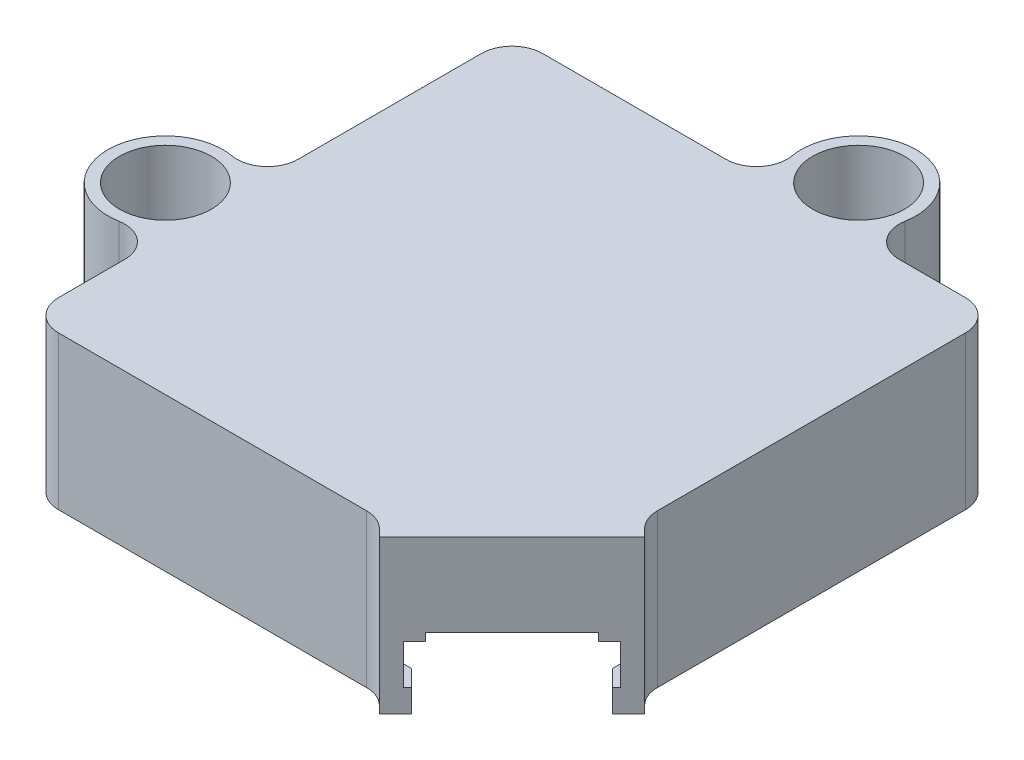
from build123d import *

# Parameters (mm, degrees)
SKETCH1_W           = 31.6
SKETCH1_H           = 31.6
SKETCH1_W_2         = 28.6
SKETCH1_H_2         = 28.6
BOSS_EXTRUDE1_DEPTH = 10
SKETCH2_W           = 31.6
SKETCH2_H           = 31.6
BOSS_EXTRUDE2_DEPTH = 1.5
FILLET2_R           = 2
SKETCH3_R           = 3.75
SKETCH3_R_2         = 1.75
BOSS_EXTRUDE3_DEPTH = 10
SKETCH4_R           = 3
CUT_EXTRUDE1_DEPTH  = 8.5
CUT_EXTRUDE2_REACH  = 35.43
SKETCH6_W           = 29.5
SKETCH6_H           = 29.5
CUT_EXTRUDE3_DEPTH  = 1.5
FILLET3_R           = 2
BOSS_EXTRUDE4_DEPTH = 5.4
BOSS_EXTRUDE5_DEPTH = 4.6
BOSS_EXTRUDE6_DEPTH = 3.1
FILLET4_R           = 2
CUT_EXTRUDE6_START  = -2.5
SKETCH12_W          = 10
SKETCH12_H          = 2.6
CUT_EXTRUDE6_DEPTH  = 2.5


with BuildPart() as part:
    # Sketch1 → Boss-Extrude1 (new body)
    with BuildSketch(Plane(origin=(0, 0, 0), x_dir=(1, 0, 0), z_dir=(0, 1, 0))):
        Rectangle(SKETCH1_W, SKETCH1_H)
        Rectangle(SKETCH1_W_2, SKETCH1_H_2, mode=Mode.SUBTRACT)
    extrude(amount=BOSS_EXTRUDE1_DEPTH)

    # Sketch2 → Boss-Extrude2 (add)
    with BuildSketch(Plane.XZ.offset(-10)):
        Rectangle(SKETCH2_W, SKETCH2_H)
    extrude(amount=BOSS_EXTRUDE2_DEPTH)

    # Fillet2
    fillet2_edges = [part.edges().sort_by_distance(p)[0] for p in [
        (-15.8, 5, -15.8),
        (15.8, 5, -15.8),
        (15.8, 5, 15.8),
        (-15.8, 5, 15.8),
    ]]
    fillet(fillet2_edges, radius=FILLET2_R)

    # Sketch3 → Boss-Extrude3 (add)
    # profile 1 of 2: a face of its own
    with BuildSketch(Plane(origin=(0, 0, 0), x_dir=(1, 0, 0), z_dir=(0, 1, 0))):
        with Locations((-18.806316011, -3.821100987)):
            Circle(SKETCH3_R)
        with Locations(Location((-18.806316011, -3.821100987, 0), (0, 0, 90))):
            Circle(SKETCH3_R_2, mode=Mode.SUBTRACT)
    # profile 2 of 2: a face of its own
    with BuildSketch(Plane(origin=(0, 0, 0), x_dir=(1, 0, 0), z_dir=(0, 1, 0))):
        with Locations((3.821100987, 18.806316011)):
            Circle(SKETCH3_R)
        with Locations(Location((3.821100987, 18.806316011, 0), (0, 0, 90))):
            Circle(SKETCH3_R_2, mode=Mode.SUBTRACT)
    extrude(amount=BOSS_EXTRUDE3_DEPTH)

    # Sketch4 → Cut-Extrude1 (cut)
    with BuildSketch(Plane(origin=(0, 10, 0), x_dir=(1, 0, 0), z_dir=(0, 1, 0))):
        with Locations(Location((-18.806316011, -3.821100987, 0), (0, 0, 270))):
            Circle(SKETCH4_R)
        with Locations(Location((3.821100987, 18.806316011, 0), (0, 0, 270))):
            Circle(SKETCH4_R)
    extrude(amount=-CUT_EXTRUDE1_DEPTH, mode=Mode.SUBTRACT)

    # Sketch5 → Cut-Extrude2 (cut, up to next)
    with BuildSketch(Plane.XZ, mode=Mode.PRIVATE) as cut_extrude2_sk1:
        Polygon((14.3, 14.3), (8.643145751, 14.3), (14.3, 8.643145751), align=None)
    cut_extrude2_tool1 = extrude(cut_extrude2_sk1.sketch, amount=-CUT_EXTRUDE2_REACH, mode=Mode.PRIVATE) & part.part
    # Sketch5 → Cut-Extrude2 (cut, up to next)
    with BuildSketch(Plane.XZ, mode=Mode.PRIVATE) as cut_extrude2_sk2:
        with BuildLine():
            Line((13.8, 15.8), (7.143145751, 15.8))
            Line((7.143145751, 15.8), (8.643145751, 14.3))
            Line((8.643145751, 14.3), (14.3, 14.3))
            Line((14.3, 14.3), (14.3, 8.643145751))
            Line((14.3, 8.643145751), (15.8, 7.143145751))
            Line((15.8, 7.143145751), (15.8, 13.8))
            ThreePointArc((15.8, 13.8), (15.214213562, 15.214213562), (13.8, 15.8))
        make_face()
    cut_extrude2_tool2 = extrude(cut_extrude2_sk2.sketch, amount=-CUT_EXTRUDE2_REACH, mode=Mode.PRIVATE) & part.part
    add(cut_extrude2_tool1.solids().sort_by_distance((12.414382, 0, 12.414382))[0], mode=Mode.SUBTRACT)
    add(cut_extrude2_tool2.solids().sort_by_distance((15.127645, 0, 15.127645))[0], mode=Mode.SUBTRACT)

    # Sketch6 → Cut-Extrude3 (cut)
    with BuildSketch(Plane.XZ):
        Rectangle(SKETCH6_W, SKETCH6_H)
    extrude(amount=-CUT_EXTRUDE3_DEPTH, mode=Mode.SUBTRACT)

    # Fillet3
    fillet3_edges = [part.edges().sort_by_distance(p)[0] for p in [
        (6.062654922, 5, -15.8),
        (1.579547052, 5, -15.8),
        (-15.8, 5, 1.579547052),
        (-15.8, 5, 6.062654922),
    ]]
    fillet(fillet3_edges, radius=FILLET3_R)

    # Sketch7 → Boss-Extrude4 (add)
    with BuildSketch(Plane(origin=(0, 10, 0), x_dir=(1, 0, 0), z_dir=(0, 1, 0))):
        Polygon((8.203805922, -16.860660172), (7.143145751, -15.8), (15.8, -7.143145751), (16.860660172, -8.203805922), align=None)
    extrude(amount=-BOSS_EXTRUDE4_DEPTH)

    # Sketch8 → Boss-Extrude5 (add)
    with BuildSketch(Plane.XZ.offset(-4.6)):
        Polygon((7.143145751, 15.8), (8.193145751, 14.75), (9.253805922, 15.810660172), (8.203805922, 16.860660172), align=None)
        Polygon((16.860660172, 8.203805922), (15.810660172, 9.253805922), (14.75, 8.193145751), (15.8, 7.143145751), align=None)
    extrude(amount=BOSS_EXTRUDE5_DEPTH)

    # Sketch9 → Boss-Extrude6 (add)
    with BuildSketch(Plane.XZ.offset(-4.6)):
        Polygon((8.193145751, 14.75), (8.643145751, 14.3), (9.703805922, 15.360660172), (9.253805922, 15.810660172), align=None)
        Polygon((15.360660172, 9.703805922), (14.3, 8.643145751), (14.75, 8.193145751), (15.810660172, 9.253805922), align=None)
    extrude(amount=BOSS_EXTRUDE6_DEPTH)

    # Fillet4
    fillet4_edges = [part.edges().sort_by_distance(p)[0] for p in [
        (7.143145751, 5, 15.8),
        (15.8, 5, 7.143145751),
    ]]
    fillet(fillet4_edges, radius=FILLET4_R)

    # Sketch12 → Cut-Extrude6 (cut)
    with BuildSketch(Plane(origin=(12.532233047, 0, 12.532233047), x_dir=(0.7071067811865475, 0, -0.7071067811865477), z_dir=(0.7071067811865477, 0, 0.7071067811865475)).offset(CUT_EXTRUDE6_START)):
        with Locations((0, 2.8)):
            Rectangle(SKETCH12_W, SKETCH12_H)
    extrude(amount=CUT_EXTRUDE6_DEPTH, mode=Mode.SUBTRACT)


solid = part.part
